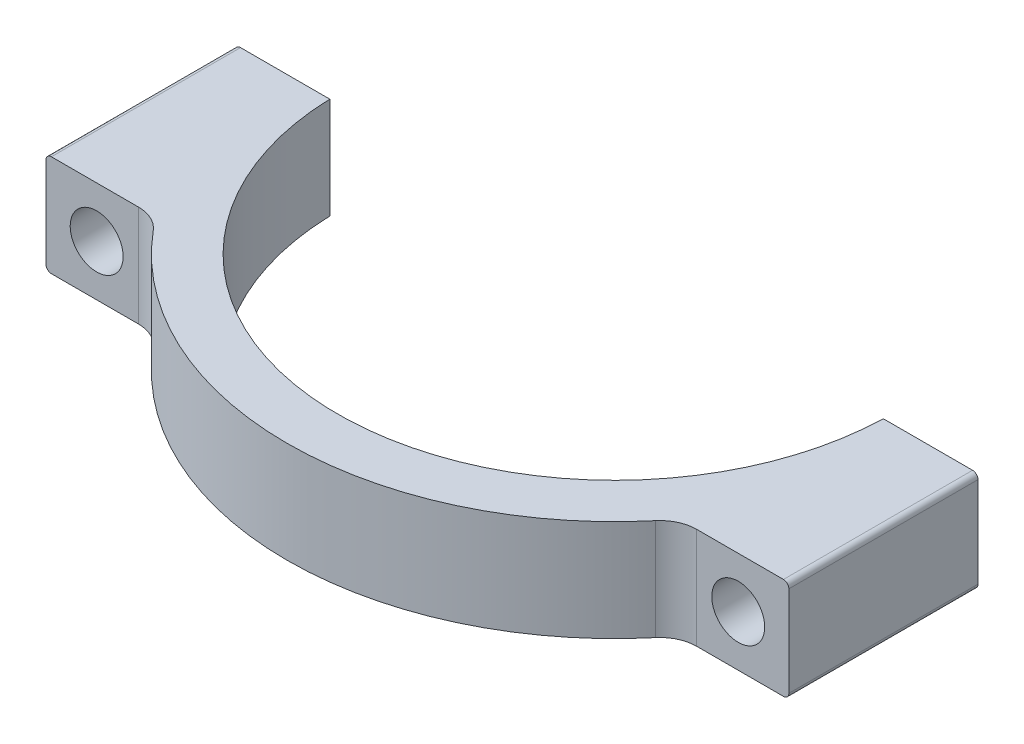
from build123d import *

# Parameters (mm, degrees)
BOSS_EXTRUDE1_DEPTH    = 4.7625
F_10_CLEARANCE_HOLE1_D = 4.9784
CUT_EXTRUDE2_DEPTH     = 48.038415261
FILLET1_R              = 3.429
FILLET2_R              = 0.508


with BuildPart() as part:
    # Sketch1 → Boss-Extrude1 (new, symmetric)
    with BuildSketch(Plane(origin=(0, 0, 0), x_dir=(1, 0, 0), z_dir=(0, 1, 0))):
        with BuildLine():
            Line((-26.023846391, 30.0355), (-34.925, 30.0355))
            Line((-34.925, 30.0355), (-34.925, 0))
            Line((-34.925, 0), (34.925, 0))
            Line((34.925, 0), (34.925, 30.0355))
            Line((34.925, 30.0355), (26.023846391, 30.0355))
            ThreePointArc((26.023846391, 30.0355), (0, 4.7625), (-26.023846391, 30.0355))
        make_face()
    extrude(amount=BOSS_EXTRUDE1_DEPTH, both=True)

    # #10 Clearance Hole1 (through all)
    with Locations(Plane(origin=(0, 0, -30.0355), x_dir=(-1, 0, 0), z_dir=(0, 0, -1))):
        with Locations((-30.1625, 0), (30.1625, 0)):
            Hole(F_10_CLEARANCE_HOLE1_D / 2)

    # Sketch6 → Cut-Extrude2 (cut, through all)
    with BuildSketch(Plane.XZ.offset(4.7625)):
        with BuildLine():
            Line((-24.590246893, -12.2555), (-34.925, -12.2555))
            Line((-34.925, -12.2555), (-34.925, 0))
            Line((-34.925, 0), (0, 0))
            ThreePointArc((0, 0), (-13.737517266, -3.23363551), (-24.590246893, -12.2555))
        make_face()
    cut_extrude2 = extrude(amount=-CUT_EXTRUDE2_DEPTH, mode=Mode.SUBTRACT)

    # Mirror1: Cut-Extrude2 across plane
    add(cut_extrude2.mirror(Plane(origin=(0, 0, 0), x_dir=(0, 0, 1), z_dir=(1, 0, 0))), mode=Mode.SUBTRACT)

    # Fillet1
    fillet1_edges = [part.edges().sort_by_distance(p)[0] for p in [
        (-24.590246893, 0, -12.2555),
        (24.590246893, 0, -12.2555),
    ]]
    fillet(fillet1_edges, radius=FILLET1_R)

    # Fillet2
    fillet2_edges = [part.edges().sort_by_distance(p)[0] for p in [
        (-34.925, 4.7625, -21.1455),
        (34.925, -4.7625, -21.1455),
        (34.925, 4.7625, -21.1455),
        (-34.925, -4.7625, -21.1455),
    ]]
    fillet(fillet2_edges, radius=FILLET2_R)


solid = part.part
